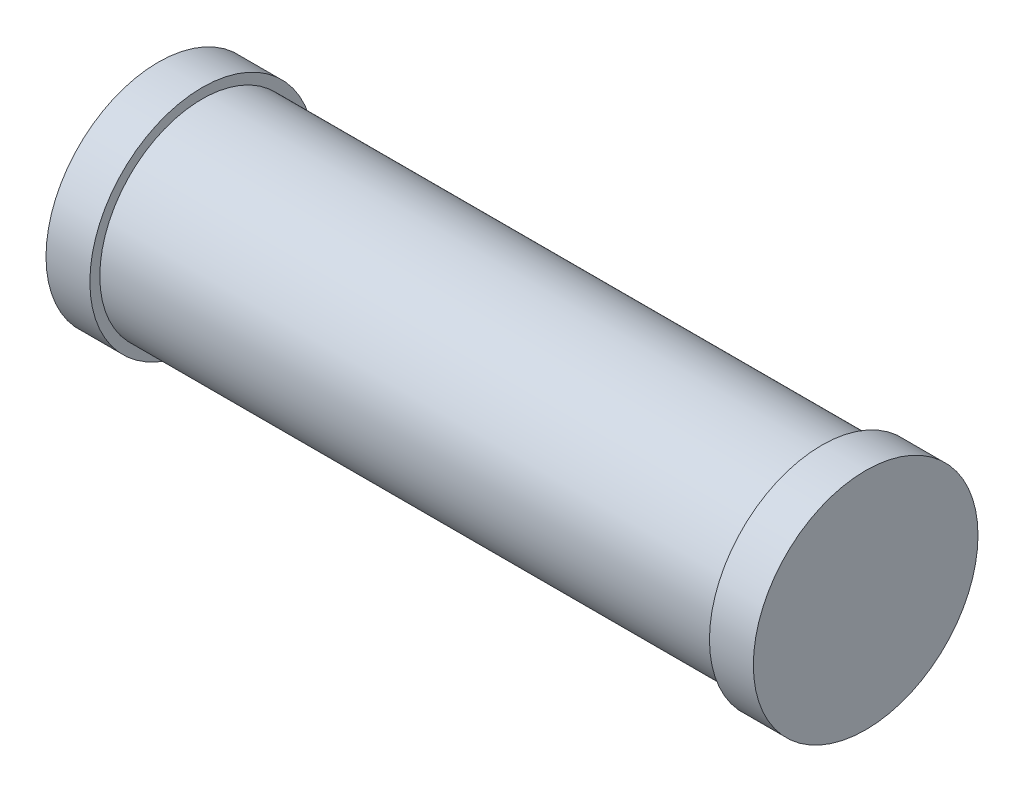
from build123d import *


with BuildPart() as part:
    # Sketch2 → Revolve1 (revolve)
    with BuildSketch(Plane(origin=(0, 0, 0), x_dir=(1, 0, 0), z_dir=(0, 1, 0))):
        Polygon((-17.65, 5.835), (17.65, 5.835), (17.65, 6.4), (20.15, 6.4), (20.15, 0), (-20.15, 0), (-20.15, 6.4), (-17.65, 6.4), align=None)
    revolve(axis=Axis((20.15, 0, 0), (-1, 0, 0)))


solid = part.part
